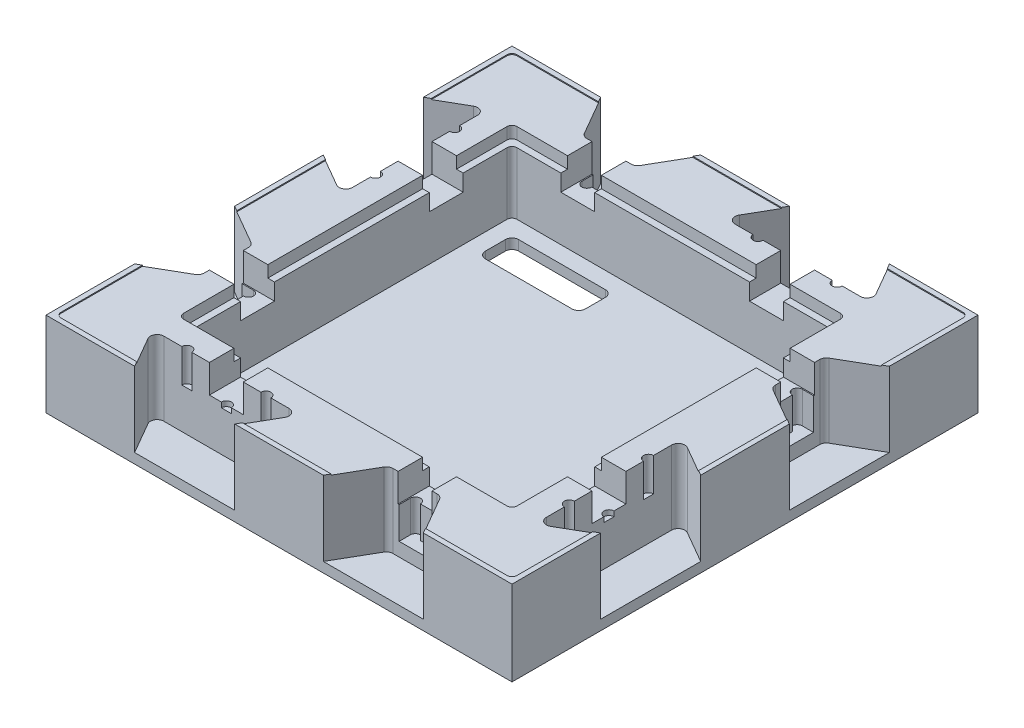
from build123d import *

# Parameters (mm, degrees)
SKETCH1_W                = 139.7
SKETCH1_H                = 139.7
BOSS_EXTRUDE1_DEPTH      = 12.7
SKETCH2_W                = 136.7
SKETCH2_H                = 136.7
CUT_EXTRUDE1_DEPTH       = 0.3
CUT_EXTRUDE2_START       = -22.4
CUT_EXTRUDE2_DEPTH       = 125.396102867
CUT_EXTRUDE4_DEPTH       = 10
SKETCH18_W               = 10.16
SKETCH18_H               = 8.48
CUT_EXTRUDE6_DEPTH       = 20
SKETCH22_W               = 9.525
SKETCH22_H               = 9.525
CUT_EXTRUDE10_DEPTH      = 3.375
SKETCH23_R               = 1.5
CUT_EXTRUDE11_DEPTH      = 9.525
FILLET1_R                = 1.5
FILLET3_R                = 2
CIRPATTERN1_COUNT        = 4
FILLET3_OF_CIRPATTERN1_R = 2
SKETCH13_W               = 100
SKETCH13_H               = 100
CUT_EXTRUDE5_DEPTH       = 22.1
SKETCH14_W               = 100
SKETCH14_H               = 100
SKETCH14_W_2             = 96
SKETCH14_H_2             = 96
BOSS_EXTRUDE2_DEPTH      = 18.6
SKETCH16_W               = 30
SKETCH16_H               = 10
VENT_SUSSY_DEPTH         = 102.290695525
CIRPATTERN5_COUNT        = 2
FILLET4_R                = 2
FILLET5_R                = 1.5
CIRPATTERN4_COUNT        = 4
SKETCH21_W               = 10.16
SKETCH21_H               = 4.98
CUT_EXTRUDE9_DEPTH       = 2


with BuildPart() as part:
    # Sketch1 → Boss-Extrude1 (new, symmetric)
    with BuildSketch(Plane(origin=(0, 0, 0), x_dir=(1, 0, 0), z_dir=(0, 1, 0))):
        Rectangle(SKETCH1_W, SKETCH1_H)
    extrude(amount=BOSS_EXTRUDE1_DEPTH, both=True)

    # Sketch2 → Cut-Extrude1 (cut)
    with BuildSketch(Plane(origin=(0, 12.7, 0), x_dir=(1, 0, 0), z_dir=(0, 1, 0))):
        Rectangle(SKETCH2_W, SKETCH2_H)
    extrude(amount=-CUT_EXTRUDE1_DEPTH, mode=Mode.SUBTRACT)

    # Sketch4 → Cut-Extrude2 (cut)
    with BuildSketch(Plane(origin=(0, 12.7, 0), x_dir=(1, 0, 0), z_dir=(0, 1, 0)).offset(CUT_EXTRUDE2_START)):
        Polygon((-43.283333333, -69.85), (-50.500211698, -57.35), (-6.066454968, -57.35), (-13.283333333, -69.85), align=None)
        Polygon((43.283333333, -69.85), (36.066454968, -57.35), (20.500211698, -57.35), (13.283333333, -69.85), align=None)
    cut_extrude2 = extrude(amount=CUT_EXTRUDE2_DEPTH, mode=Mode.SUBTRACT)

    # Sketch6 → Cut-Extrude4 (cut)
    with BuildSketch(Plane(origin=(0, 12.4, 0), x_dir=(1, 0, 0), z_dir=(0, 1, 0))):
        with BuildLine():
            Line((-41.641772516, -57.35), (-38.641772516, -57.35))
            ThreePointArc((-38.641772516, -57.35), (-40.141772516, -55.85), (-41.641772516, -57.35))
        make_face()
        with BuildLine():
            Line((-29.783333333, -57.35), (-26.783333333, -57.35))
            ThreePointArc((-26.783333333, -57.35), (-28.283333333, -55.85), (-29.783333333, -57.35))
        make_face()
        with BuildLine():
            Line((-17.924894151, -57.35), (-14.924894151, -57.35))
            ThreePointArc((-14.924894151, -57.35), (-16.424894151, -55.85), (-17.924894151, -57.35))
        make_face()
    cut_extrude4 = extrude(amount=-CUT_EXTRUDE4_DEPTH, mode=Mode.SUBTRACT)

    # Sketch18 → Cut-Extrude6 (cut)
    with BuildSketch(Plane.XY.offset(57.35)):
        with Locations((28.283333333, 8.16)):
            Rectangle(SKETCH18_W, SKETCH18_H)
        with Locations((-28.283333333, 8.16)):
            Rectangle(SKETCH18_W, SKETCH18_H)
    cut_extrude6 = extrude(amount=-CUT_EXTRUDE6_DEPTH, mode=Mode.SUBTRACT)

    # Sketch22 → Cut-Extrude10 (cut)
    with BuildSketch(Plane.XY.offset(57.35)):
        with Locations((28.283333333, -0.8425)):
            Rectangle(SKETCH22_W, SKETCH22_H)
    cut_extrude10 = extrude(amount=-CUT_EXTRUDE10_DEPTH, mode=Mode.SUBTRACT)

    # Sketch23 → Cut-Extrude11 (cut)
    with BuildSketch(Plane(origin=(0, 3.92, 0), x_dir=(1, 0, 0), z_dir=(0, 1, 0))):
        with Locations((25.020833333, -53.975)):
            Circle(SKETCH23_R)
        with Locations((31.545833333, -53.975)):
            Circle(SKETCH23_R)
    cut_extrude11 = extrude(amount=-CUT_EXTRUDE11_DEPTH, mode=Mode.SUBTRACT)

    # Fillet1
    fillet1_edges = [part.edges().sort_by_distance(p)[0] for p in [
        (-68.35, 12.55, -68.35),
        (-68.35, 12.55, 68.35),
        (68.35, 12.55, 68.35),
        (68.35, 12.55, -68.35),
    ]]
    fillet(fillet1_edges, radius=FILLET1_R)

    # Fillet3
    fillet3_edges = [part.edges().sort_by_distance(p)[0] for p in [
        (-50.500211698, 1.35, 57.35),
        (-6.066454968, 1.35, 57.35),
        (20.500211698, 1.35, 57.35),
        (36.066454968, 1.35, 57.35),
    ]]
    fillet(fillet3_edges, radius=FILLET3_R)

    # CirPattern1: Cut-Extrude2, Cut-Extrude4, Cut-Extrude10, Cut-Extrude11 ×4 about axis
    cirpattern1_axis = Axis((0, 0, 0), (0, 1, 0))
    add([cut_extrude2.rotate(cirpattern1_axis, i * 360 / CIRPATTERN1_COUNT) for i in range(1, CIRPATTERN1_COUNT)], mode=Mode.SUBTRACT)
    add([cut_extrude4.rotate(cirpattern1_axis, i * 360 / CIRPATTERN1_COUNT) for i in range(1, CIRPATTERN1_COUNT)], mode=Mode.SUBTRACT)
    add([cut_extrude10.rotate(cirpattern1_axis, i * 360 / CIRPATTERN1_COUNT) for i in range(1, CIRPATTERN1_COUNT)], mode=Mode.SUBTRACT)
    add([cut_extrude11.rotate(cirpattern1_axis, i * 360 / CIRPATTERN1_COUNT) for i in range(1, CIRPATTERN1_COUNT)], mode=Mode.SUBTRACT)

    # Fillet3 of CirPattern1
    fillet3_of_cirpattern1_edges = [part.edges().sort_by_distance(p)[0] for p in [
        (57.35, 1.35, 50.500211698),
        (57.35, 1.35, 6.066454968),
        (57.35, 1.35, -20.500211698),
        (57.35, 1.35, -36.066454968),
        (50.500211698, 1.35, -57.35),
        (6.066454968, 1.35, -57.35),
        (-20.500211698, 1.35, -57.35),
        (-36.066454968, 1.35, -57.35),
        (-57.35, 1.35, -50.500211698),
        (-57.35, 1.35, -6.066454968),
        (-57.35, 1.35, 20.500211698),
        (-57.35, 1.35, 36.066454968),
    ]]
    fillet(fillet3_of_cirpattern1_edges, radius=FILLET3_OF_CIRPATTERN1_R)

    # Sketch13 → Cut-Extrude5 (cut)
    with BuildSketch(Plane(origin=(0, 12.4, 0), x_dir=(1, 0, 0), z_dir=(0, 1, 0))):
        Rectangle(SKETCH13_W, SKETCH13_H)
    extrude(amount=-CUT_EXTRUDE5_DEPTH, mode=Mode.SUBTRACT)

    # Sketch14 → Boss-Extrude2 (add)
    with BuildSketch(Plane(origin=(0, -9.7, 0), x_dir=(1, 0, 0), z_dir=(0, 1, 0))):
        Rectangle(SKETCH14_W, SKETCH14_H)
        Rectangle(SKETCH14_W_2, SKETCH14_H_2, mode=Mode.SUBTRACT)
    extrude(amount=BOSS_EXTRUDE2_DEPTH)

    # Sketch16 → Vent_Sussy (cut, through all)
    with BuildSketch(Plane(origin=(0, -9.7, 0), x_dir=(1, 0, 0), z_dir=(0, 1, 0))):
        with Locations((-28, 38)):
            Rectangle(SKETCH16_W, SKETCH16_H)
    vent_sussy = extrude(amount=-VENT_SUSSY_DEPTH, mode=Mode.SUBTRACT)

    # CirPattern5: Vent_Sussy ×2 about axis
    cirpattern5_axis = Axis((0, 0, 0), (0, 1, 0))
    for i in range(1, CIRPATTERN5_COUNT):
        add(vent_sussy.rotate(cirpattern5_axis, i * 360 / CIRPATTERN5_COUNT), mode=Mode.SUBTRACT)

    # Fillet4
    fillet4_edges = [part.edges().sort_by_distance(p)[0] for p in [
        (-43, -11.2, -33),
        (-43, -11.2, -43),
        (-13, -11.2, -43),
        (-13, -11.2, -33),
        (43, -11.2, 33),
        (43, -11.2, 43),
        (13, -11.2, 43),
        (13, -11.2, 33),
    ]]
    fillet(fillet4_edges, radius=FILLET4_R)

    # Fillet5
    fillet5_edges = [part.edges().sort_by_distance(p)[0] for p in [
        (50, 10.65, 50),
        (50, 10.65, -50),
        (-50, 10.65, -50),
        (-50, 10.65, 50),
        (48, -0.4, -48),
        (-48, -0.4, -48),
        (-48, -0.4, 48),
        (48, -0.4, 48),
    ]]
    fillet(fillet5_edges, radius=FILLET5_R)

    # CirPattern4: Cut-Extrude6 ×4 about axis
    cirpattern4_axis = Axis((0, 0, 0), (0, 1, 0))
    for i in range(1, CIRPATTERN4_COUNT):
        add(cut_extrude6.rotate(cirpattern4_axis, i * 360 / CIRPATTERN4_COUNT), mode=Mode.SUBTRACT)

    # Sketch21 → Cut-Extrude9 (cut)
    with BuildSketch(Plane.XY.offset(50)):
        with Locations((28.283333333, 6.41)):
            Rectangle(SKETCH21_W, SKETCH21_H)
        with Locations((-28.283333333, 6.41)):
            Rectangle(SKETCH21_W, SKETCH21_H)
    extrude(amount=-CUT_EXTRUDE9_DEPTH, mode=Mode.SUBTRACT)


solid = part.part
